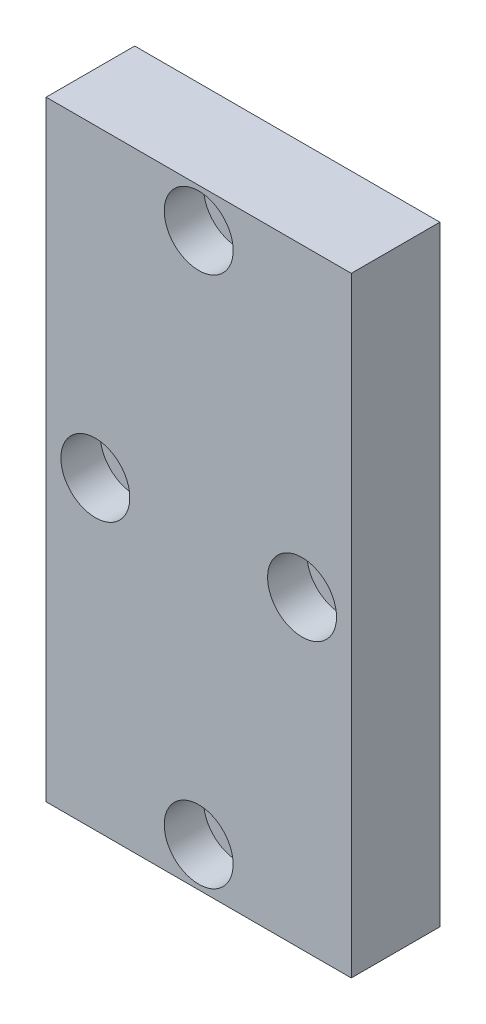
from build123d import *

# Parameters (mm, degrees)
SKETCH1_W           = 31
SKETCH1_H           = 62
BOSS_EXTRUDE1_DEPTH = 9
SKETCH2_R           = 2
CUT_EXTRUDE1_DEPTH  = 10
SKETCH3_R           = 3.5
CUT_EXTRUDE2_DEPTH  = 4


with BuildPart() as part:
    # Sketch1 → Boss-Extrude1 (new body)
    with BuildSketch(Plane.XY):
        Rectangle(SKETCH1_W, SKETCH1_H)
    extrude(amount=BOSS_EXTRUDE1_DEPTH)

    # Sketch2 → Cut-Extrude1 (cut)
    with BuildSketch(Plane.XY.offset(9)):
        with Locations((0, 27)):
            Circle(SKETCH2_R)
        with Locations((0, -27)):
            Circle(SKETCH2_R)
        with Locations((10.5, 0)):
            Circle(SKETCH2_R)
        with Locations((-10.5, 0)):
            Circle(SKETCH2_R)
    extrude(amount=-CUT_EXTRUDE1_DEPTH, mode=Mode.SUBTRACT)

    # Sketch3 → Cut-Extrude2 (cut)
    with BuildSketch(Plane.XY.offset(9)):
        with Locations((0, 27)):
            Circle(SKETCH3_R)
        with Locations((10.5, 0)):
            Circle(SKETCH3_R)
        with Locations(Location((-10.5, 0, 0), (0, 0, 180))):
            Circle(SKETCH3_R)
        with Locations(Location((0, -27, 0), (0, 0, 180))):
            Circle(SKETCH3_R)
    extrude(amount=-CUT_EXTRUDE2_DEPTH, mode=Mode.SUBTRACT)


solid = part.part
